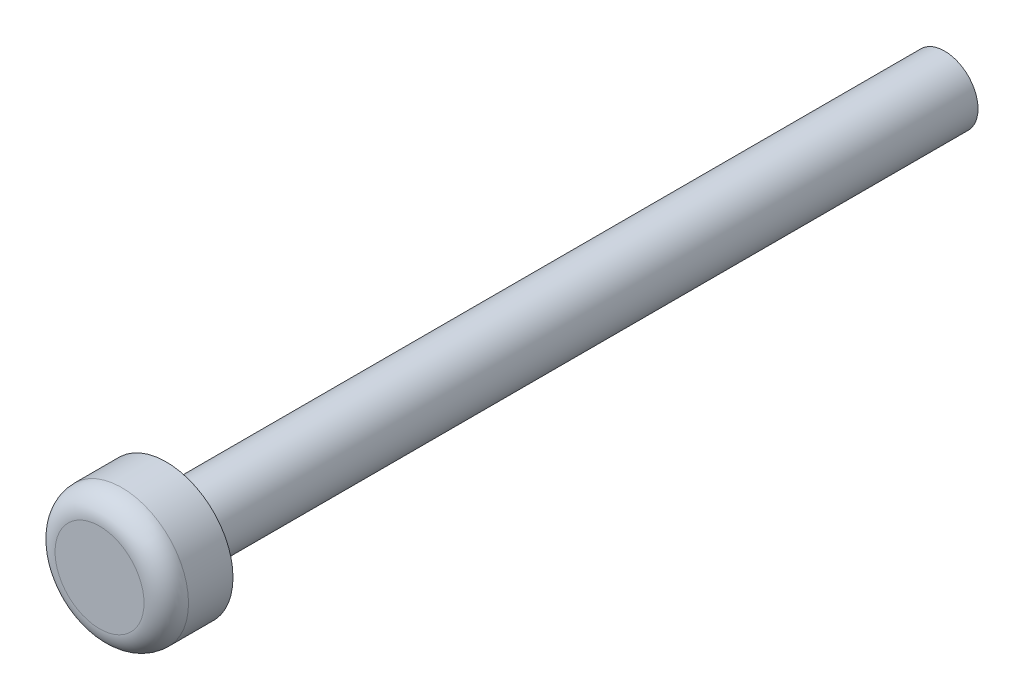
from build123d import *

# Parameters (mm, degrees)
SKETCH1_R           = 1.5
BOSS_EXTRUDE1_DEPTH = 35
SKETCH2_R           = 3
BOSS_EXTRUDE2_DEPTH = 3
FILLET1_R           = 1


with BuildPart() as part:
    # Sketch1 → Boss-Extrude1 (new body)
    with BuildSketch(Plane.XY):
        Circle(SKETCH1_R)
    extrude(amount=-BOSS_EXTRUDE1_DEPTH)

    # Sketch2 → Boss-Extrude2 (add)
    with BuildSketch(Plane.XY):
        Circle(SKETCH2_R)
    extrude(amount=BOSS_EXTRUDE2_DEPTH)

    # Fillet1
    fillet1_edges = [part.edges().sort_by_distance(p)[0] for p in [
        (-3, 0, 3),
    ]]
    fillet(fillet1_edges, radius=FILLET1_R)


solid = part.part
